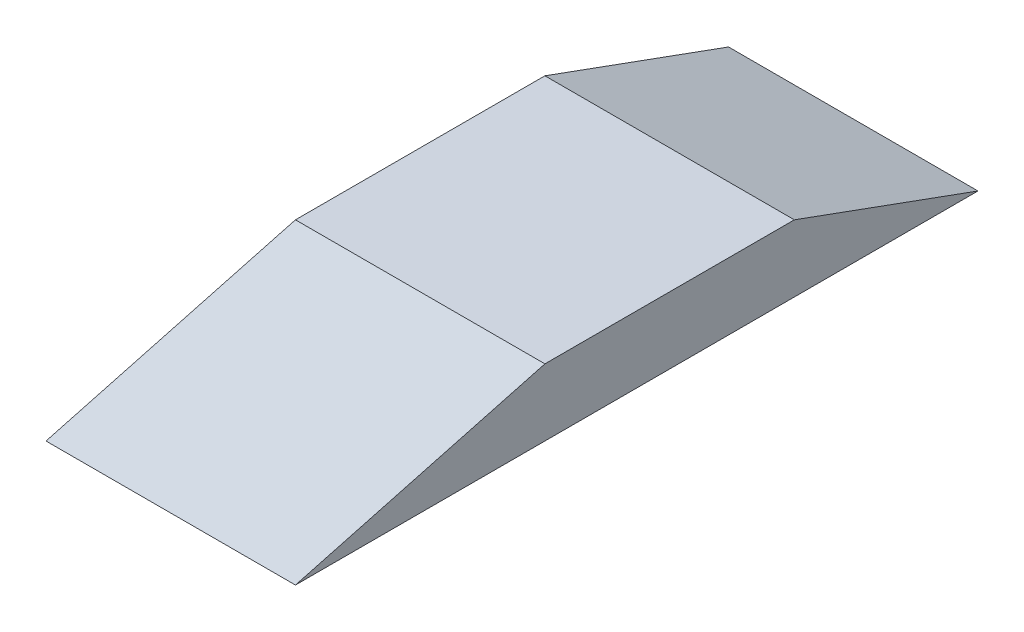
from build123d import *

# Parameters (mm, degrees)
EXTRUDE_1_DEPTH = 1500


with BuildPart() as part:
    # 草图1 → 凸台-拉伸1 (new body)
    with BuildSketch(Plane(origin=(0, 0, 0), x_dir=(0, 0, -1), z_dir=(1, 0, 0))):
        Polygon((4104.276533648, 0), (1500, 0), (1500, 401.923788647), (3000, 401.923788647), align=None)
        Polygon((1500, 0), (1500, 401.923788647), (0, 0), align=None)
    extrude(amount=EXTRUDE_1_DEPTH)


solid = part.part
